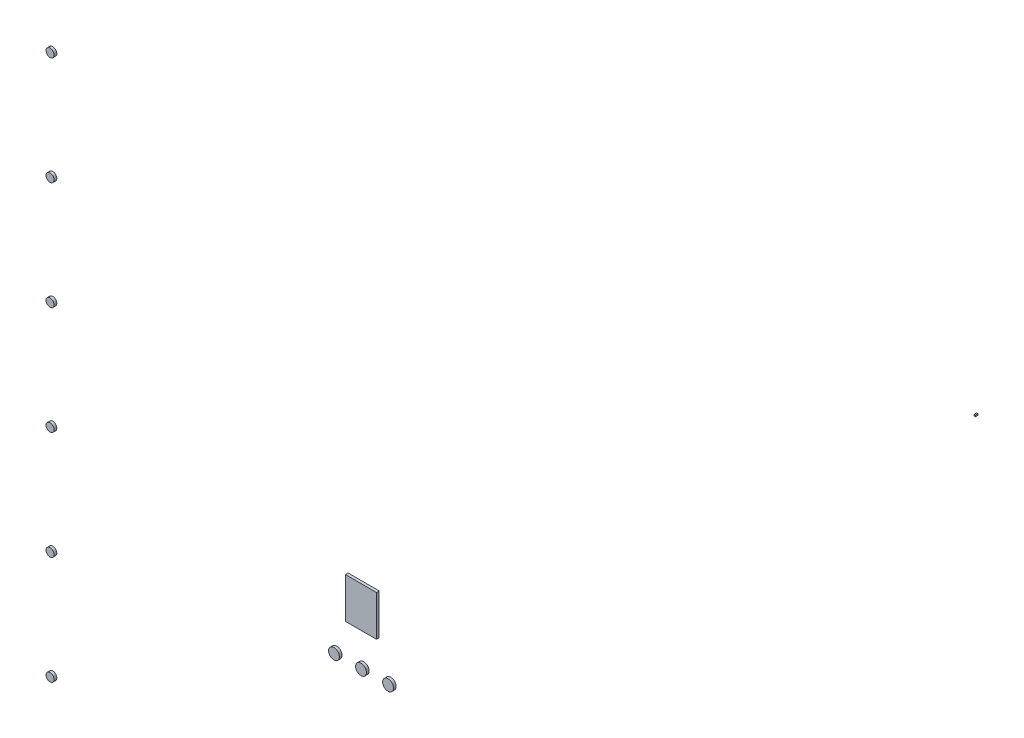
from build123d import *

# Parameters (mm, degrees)
SKETCH1_R              = 3
BOSS_EXTRUDE1_DEPTH    = 2
BOSS_EXTRUDE1_2_DEPTH  = 2
BOSS_EXTRUDE1_3_DEPTH  = 2
BOSS_EXTRUDE1_4_DEPTH  = 2
BOSS_EXTRUDE1_5_DEPTH  = 2
BOSS_EXTRUDE1_6_DEPTH  = 2
SKETCH1_W              = 23
SKETCH1_H              = 30
BOSS_EXTRUDE1_7_DEPTH  = 2
SKETCH1_R_2            = 4
BOSS_EXTRUDE1_8_DEPTH  = 2
BOSS_EXTRUDE1_9_DEPTH  = 2
BOSS_EXTRUDE1_10_DEPTH = 2
SKETCH1_W_2            = 1
SKETCH1_H_2            = 1
BOSS_EXTRUDE1_11_DEPTH = 2


with BuildPart() as part:
    # Sketch1 → Boss-Extrude1 (new body)
    with BuildSketch(Plane.XY):
        with Locations((240, 299.6)):
            Circle(SKETCH1_R)
    extrude(amount=BOSS_EXTRUDE1_DEPTH)


with BuildPart() as body_2:
    # Sketch1 → Boss-Extrude1 2 (new body)
    with BuildSketch(Plane.XY):
        with Locations((240, 379.6)):
            Circle(SKETCH1_R)
    extrude(amount=BOSS_EXTRUDE1_2_DEPTH)


with BuildPart() as body_3:
    # Sketch1 → Boss-Extrude1 3 (new body)
    with BuildSketch(Plane.XY):
        with Locations((240, 459.6)):
            Circle(SKETCH1_R)
    extrude(amount=BOSS_EXTRUDE1_3_DEPTH)


with BuildPart() as body_4:
    # Sketch1 → Boss-Extrude1 4 (new body)
    with BuildSketch(Plane.XY):
        with Locations((240, 219.6)):
            Circle(SKETCH1_R)
    extrude(amount=BOSS_EXTRUDE1_4_DEPTH)


with BuildPart() as body_5:
    # Sketch1 → Boss-Extrude1 5 (new body)
    with BuildSketch(Plane.XY):
        with Locations((240, 139.6)):
            Circle(SKETCH1_R)
    extrude(amount=BOSS_EXTRUDE1_5_DEPTH)


with BuildPart() as body_6:
    # Sketch1 → Boss-Extrude1 6 (new body)
    with BuildSketch(Plane.XY):
        with Locations((240, 59.6)):
            Circle(SKETCH1_R)
    extrude(amount=BOSS_EXTRUDE1_6_DEPTH)


with BuildPart() as body_7:
    # Sketch1 → Boss-Extrude1 7 (new body)
    with BuildSketch(Plane.XY):
        with Locations((470, 219.6)):
            Rectangle(SKETCH1_W, SKETCH1_H)
    extrude(amount=BOSS_EXTRUDE1_7_DEPTH)


with BuildPart() as body_8:
    # Sketch1 → Boss-Extrude1 8 (new body)
    with BuildSketch(Plane.XY):
        with Locations((490, 179.6)):
            Circle(SKETCH1_R_2)
    extrude(amount=BOSS_EXTRUDE1_8_DEPTH)


with BuildPart() as body_9:
    # Sketch1 → Boss-Extrude1 9 (new body)
    with BuildSketch(Plane.XY):
        with Locations((470, 179.6)):
            Circle(SKETCH1_R_2)
    extrude(amount=BOSS_EXTRUDE1_9_DEPTH)


with BuildPart() as body_10:
    # Sketch1 → Boss-Extrude1 10 (new body)
    with BuildSketch(Plane.XY):
        with Locations((450, 179.6)):
            Circle(SKETCH1_R_2)
    extrude(amount=BOSS_EXTRUDE1_10_DEPTH)


with BuildPart() as body_11:
    # Sketch1 → Boss-Extrude1 11 (new body)
    with BuildSketch(Plane.XY):
        with Locations((923.9, 569.1)):
            Rectangle(SKETCH1_W_2, SKETCH1_H_2)
    extrude(amount=BOSS_EXTRUDE1_11_DEPTH)


solid = Compound([part.part, body_2.part, body_3.part, body_4.part, body_5.part, body_6.part, body_7.part, body_8.part, body_9.part, body_10.part, body_11.part])
